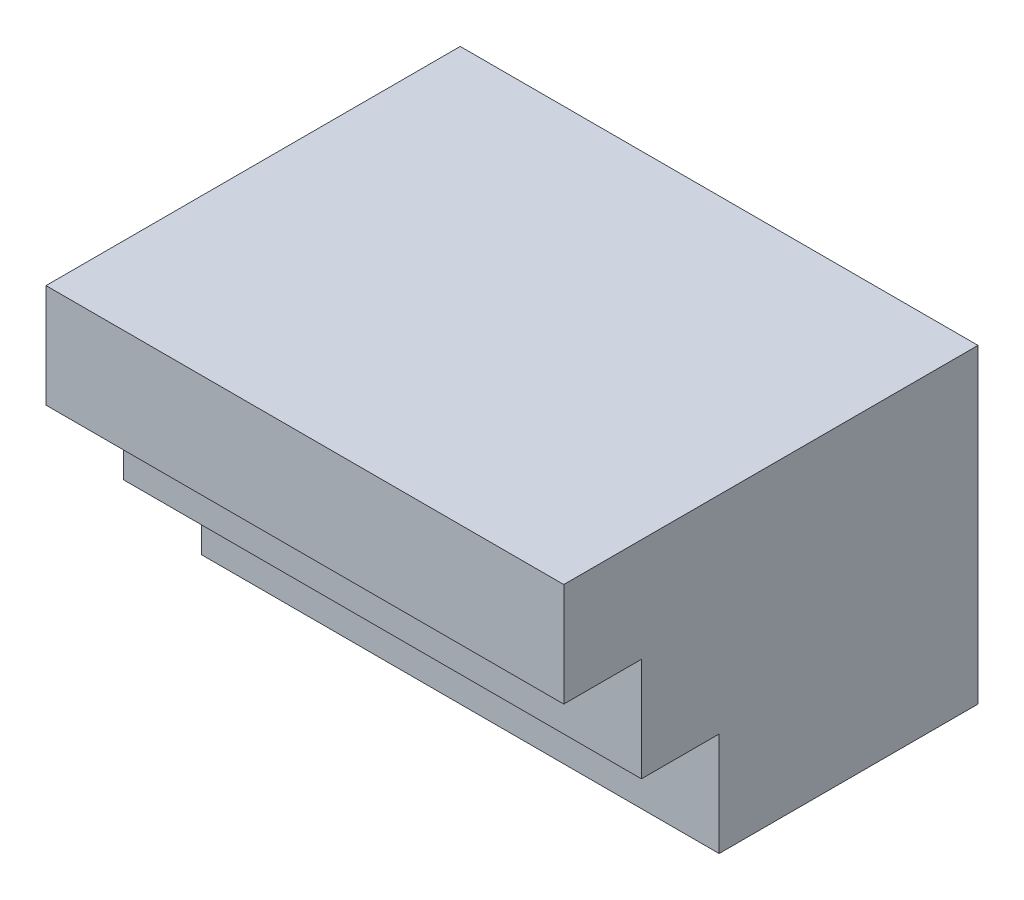
from build123d import *

# Parameters (mm, degrees)
SKETCH_1_W          = 200
SKETCH_1_H          = 40
EXTRUDE_1_DEPTH     = 100
SKETCH_1_3_W        = 200
SKETCH_1_3_H        = 40
EXTRUDE_2_DEPTH     = 130
SKETCH_9_R          = 5
CUT_EXTRUDE_4_DEPTH = 35
CUT_EXTRUDE_4_DRAFT = -1
SKETCH_9_3_R        = 5
CUT_EXTRUDE_5_DEPTH = 25
CUT_EXTRUDE_5_DRAFT = -1
SKETCH_9_4_R        = 5
CUT_EXTRUDE_6_DEPTH = 30
CUT_EXTRUDE_6_DRAFT = -1
SKETCH_10_W         = 200
SKETCH_10_H         = 40
EXTRUDE_3_DEPTH     = 160


with BuildPart() as part:
    # Эскиз1 → Бобышка-Вытянуть1 (new body)
    with BuildSketch(Plane.XY):
        with Locations((100, 20)):
            Rectangle(SKETCH_1_W, SKETCH_1_H)
    extrude(amount=EXTRUDE_1_DEPTH)

    # Эскиз1<3> → Бобышка-Вытянуть2 (add)
    with BuildSketch(Plane.XY):
        with Locations((100, 60)):
            Rectangle(SKETCH_1_3_W, SKETCH_1_3_H)
    extrude(amount=EXTRUDE_2_DEPTH)


with BuildPart() as cut_extrude_4_tool:
    # Эскиз9 → Вырез-Вытянуть4 (with draft: the straight prism first)
    with BuildSketch(Plane(origin=(-3.148281851, 38.970132862, 130), x_dir=(1, 0, 0), z_dir=(0, 0, 1))):
        with Locations((42.471240213, 20)):
            Circle(SKETCH_9_R)
    extrude(amount=-CUT_EXTRUDE_4_DEPTH)
    # Вырез-Вытянуть4: the draft: its side faces are tilted about the plane it starts from
    cut_extrude_4_sides = [cut_extrude_4_tool.faces().sort_by_distance(p)[0] for p in [
        (34.322958362, 58.970132862, 112.5),
    ]]
    draft(cut_extrude_4_sides, Plane(origin=(-3.148281851, 38.970132862, 130), x_dir=(1, 0, 0), z_dir=(0, 0, 1)), CUT_EXTRUDE_4_DRAFT)


with BuildPart() as part_1:
    add(part.part)

    # Вырез-Вытянуть4: cut by cut_extrude_4_tool
    add(cut_extrude_4_tool.part, mode=Mode.SUBTRACT)


with BuildPart() as cut_extrude_5_tool:
    # Эскиз9<3> → Вырез-Вытянуть5 (with draft: the straight prism first)
    with BuildSketch(Plane(origin=(-3.148281851, 38.970132862, 130), x_dir=(1, 0, 0), z_dir=(0, 0, 1))):
        with Locations((157.511612736, 20)):
            Circle(SKETCH_9_3_R)
    extrude(amount=-CUT_EXTRUDE_5_DEPTH)
    # Вырез-Вытянуть5: the draft: its side faces are tilted about the plane it starts from
    cut_extrude_5_sides = [cut_extrude_5_tool.faces().sort_by_distance(p)[0] for p in [
        (149.363330884, 58.970132862, 117.5),
    ]]
    draft(cut_extrude_5_sides, Plane(origin=(-3.148281851, 38.970132862, 130), x_dir=(1, 0, 0), z_dir=(0, 0, 1)), CUT_EXTRUDE_5_DRAFT)


with BuildPart() as part_2:
    add(part_1.part)

    # Вырез-Вытянуть5: cut by cut_extrude_5_tool
    add(cut_extrude_5_tool.part, mode=Mode.SUBTRACT)


with BuildPart() as cut_extrude_6_tool:
    # Эскиз9<4> → Вырез-Вытянуть6 (with draft: the straight prism first)
    with BuildSketch(Plane(origin=(-3.148281851, 38.970132862, 130), x_dir=(1, 0, 0), z_dir=(0, 0, 1))):
        with Locations((100, 20)):
            Circle(SKETCH_9_4_R)
    extrude(amount=-CUT_EXTRUDE_6_DEPTH)
    # Вырез-Вытянуть6: the draft: its side faces are tilted about the plane it starts from
    cut_extrude_6_sides = [cut_extrude_6_tool.faces().sort_by_distance(p)[0] for p in [
        (91.851718149, 58.970132862, 115),
    ]]
    draft(cut_extrude_6_sides, Plane(origin=(-3.148281851, 38.970132862, 130), x_dir=(1, 0, 0), z_dir=(0, 0, 1)), CUT_EXTRUDE_6_DRAFT)


with BuildPart() as part_3:
    add(part_2.part)

    # Вырез-Вытянуть6: cut by cut_extrude_6_tool
    add(cut_extrude_6_tool.part, mode=Mode.SUBTRACT)

    # Эскиз10 → Бобышка-Вытянуть3 (add)
    with BuildSketch(Plane(origin=(0, 0, 0), x_dir=(-1, 0, 0), z_dir=(0, 0, -1))):
        with Locations((-100, 100)):
            Rectangle(SKETCH_10_W, SKETCH_10_H)
    extrude(amount=-EXTRUDE_3_DEPTH)


solid = part_3.part
